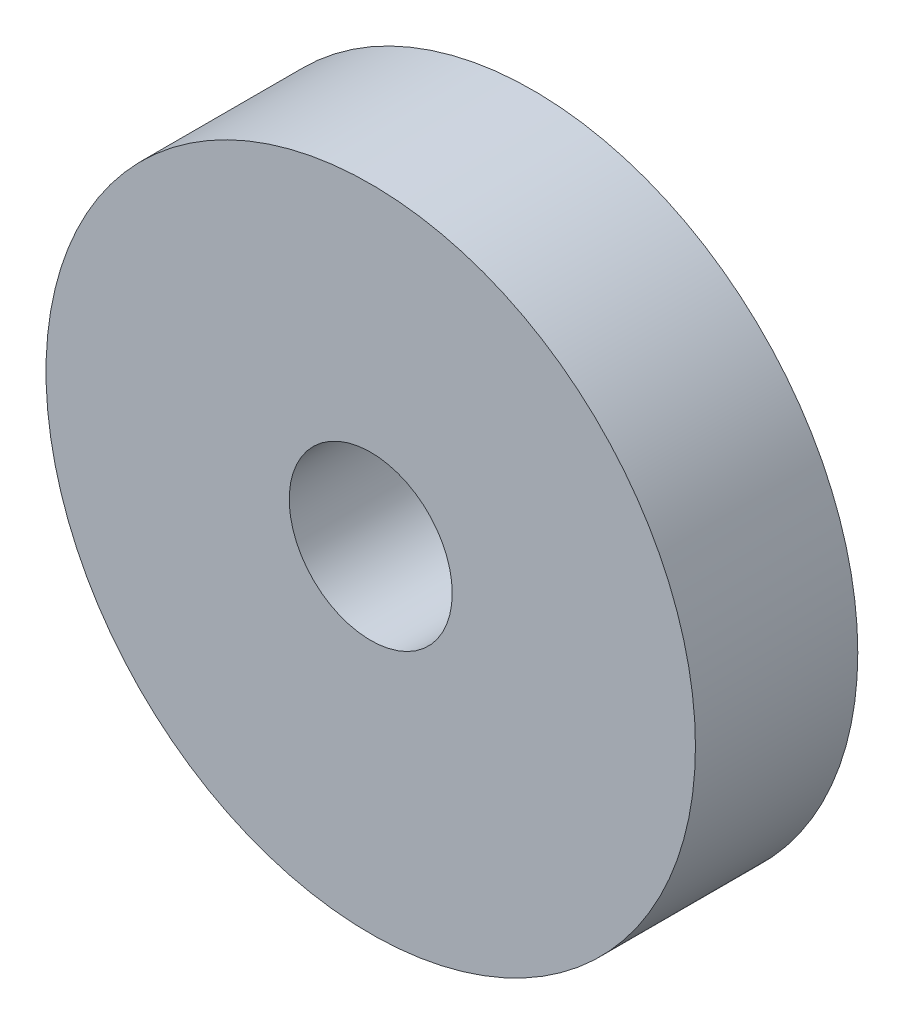
from build123d import *

# Parameters (mm, degrees)
SKETCH1_R           = 10
SKETCH1_R_2         = 2.51
BOSS_EXTRUDE1_DEPTH = 5


with BuildPart() as part:
    # Sketch1 → Boss-Extrude1 (new body)
    with BuildSketch(Plane.XY):
        Circle(SKETCH1_R)
        with Locations((0, 0.336336397)):
            Circle(SKETCH1_R_2, mode=Mode.SUBTRACT)
    extrude(amount=BOSS_EXTRUDE1_DEPTH)


solid = part.part
